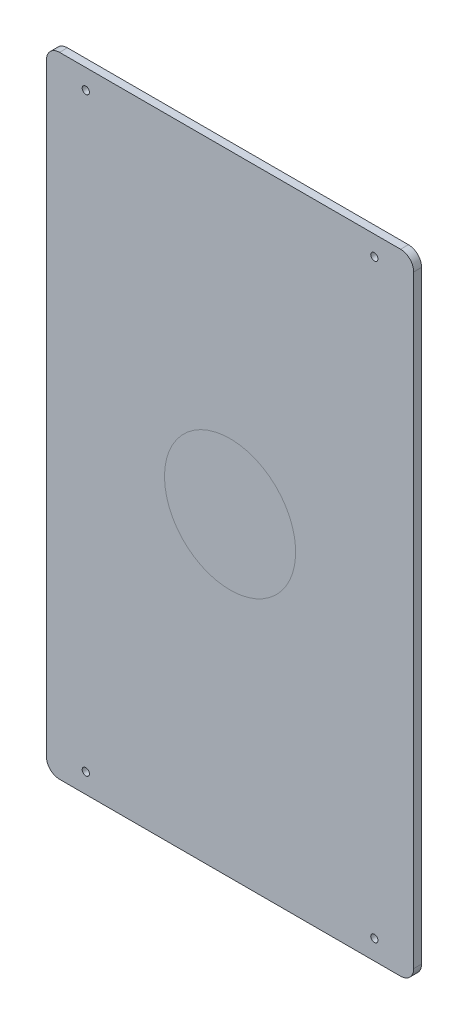
from build123d import *

# Parameters (mm, degrees)
SKETCH_1_W      = 280
SKETCH_1_H      = 480
SKETCH_1_R      = 2.75
EXTRUDE_1_DEPTH = 6
FILLET_1_R      = 10


with BuildPart() as part:
    # 草图1 → 凸台-拉伸1 (new body)
    with BuildSketch(Plane.XY):
        with Locations((110, -225)):
            Rectangle(SKETCH_1_W, SKETCH_1_H)
        Circle(SKETCH_1_R, mode=Mode.SUBTRACT)
        with Locations((220, 0)):
            Circle(SKETCH_1_R, mode=Mode.SUBTRACT)
        with Locations((220, -450)):
            Circle(SKETCH_1_R, mode=Mode.SUBTRACT)
        with Locations((0, -450)):
            Circle(SKETCH_1_R, mode=Mode.SUBTRACT)
    extrude(amount=EXTRUDE_1_DEPTH)

    # 圆角1
    fillet_1_edges = [part.edges().sort_by_distance(p)[0] for p in [
        (250, 15, 3),
        (250, -465, 3),
        (-30, -465, 3),
        (-30, 15, 3),
    ]]
    fillet(fillet_1_edges, radius=FILLET_1_R)


solid = part.part
